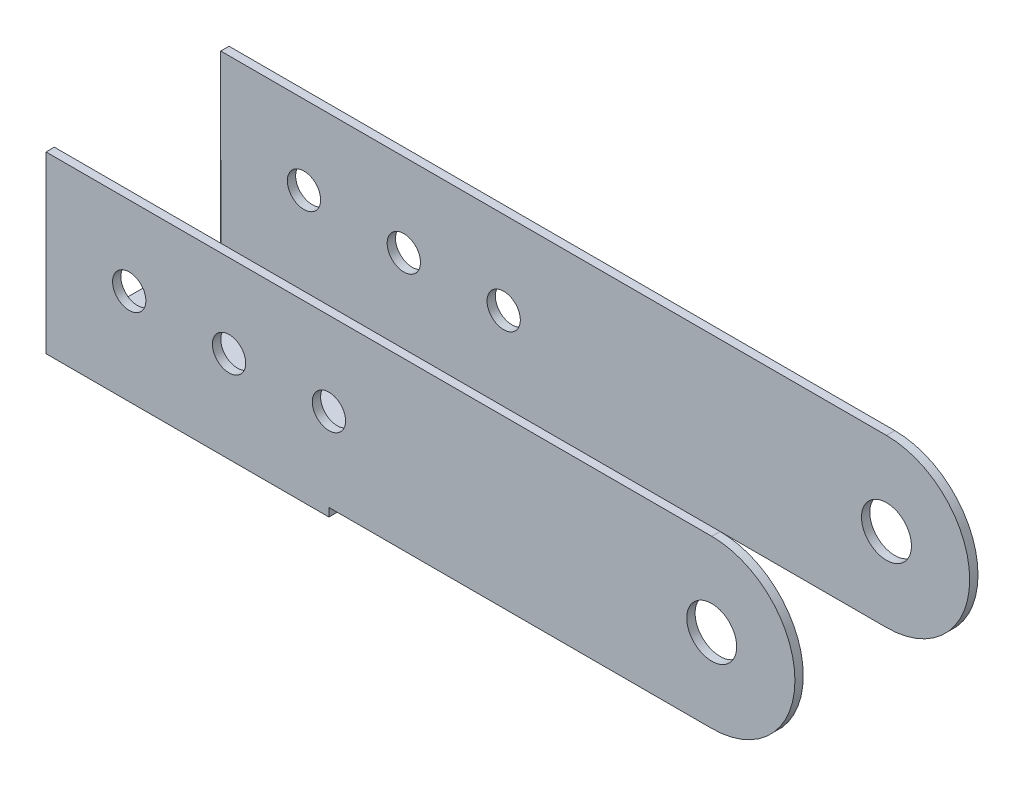
from build123d import *

# Parameters (mm, degrees)
SKETCH_2_R      = 1.5
SKETCH_2_R_2    = 1
EXTRUDE_1_DEPTH = 0.5
SKETCH_1_R      = 1.5
SKETCH_1_R_2    = 1
EXTRUDE_2_DEPTH = 0.5
SKETCH_3_W      = 17
SKETCH_3_H      = 11
EXTRUDE_3_DEPTH = 0.5


with BuildPart() as part:
    # 草图2 → 凸台-拉伸1 (new body)
    with BuildSketch(Plane.XY.offset(10)):
        with BuildLine():
            Line((15, 5), (-25, 5))
            Line((-25, 5), (-25, -5))
            Line((-25, -5), (15, -5))
            ThreePointArc((15, -5), (20, 0), (15, 5))
        make_face()
        with Locations((15, 0)):
            Circle(SKETCH_2_R, mode=Mode.SUBTRACT)
        with Locations((-8, 0)):
            Circle(SKETCH_2_R_2, mode=Mode.SUBTRACT)
        with Locations((-14, 0)):
            Circle(SKETCH_2_R_2, mode=Mode.SUBTRACT)
        with Locations((-20, 0.253438211)):
            Circle(SKETCH_2_R_2, mode=Mode.SUBTRACT)
    extrude(amount=EXTRUDE_1_DEPTH)



with BuildPart() as body_2:
    # 草图1 → 凸台-拉伸2 (new body)
    with BuildSketch(Plane.XY):
        with BuildLine():
            Line((-25, 5), (15, 5))
            ThreePointArc((15, 5), (20, 0), (15, -5))
            Line((15, -5), (-25, -5))
            Line((-25, -5), (-25, 5))
        make_face()
        with Locations((15, 0)):
            Circle(SKETCH_1_R, mode=Mode.SUBTRACT)
        with Locations((-20, 0.253438211)):
            Circle(SKETCH_1_R_2, mode=Mode.SUBTRACT)
        with Locations((-14, 0)):
            Circle(SKETCH_1_R_2, mode=Mode.SUBTRACT)
        with Locations((-8, 0)):
            Circle(SKETCH_1_R_2, mode=Mode.SUBTRACT)
    extrude(amount=-EXTRUDE_2_DEPTH)


with BuildPart() as part_1:
    add(part.part)

    add(body_2.part)  # 凸台-拉伸3 merges body 2
    # 草图3 → 凸台-拉伸3 (add)
    with BuildSketch(Plane(origin=(0, -5, 0), x_dir=(-1, 0, 0), z_dir=(0, -1, 0))):
        with Locations((16.5, -5)):
            Rectangle(SKETCH_3_W, SKETCH_3_H)
    extrude(amount=EXTRUDE_3_DEPTH)


solid = part_1.part
